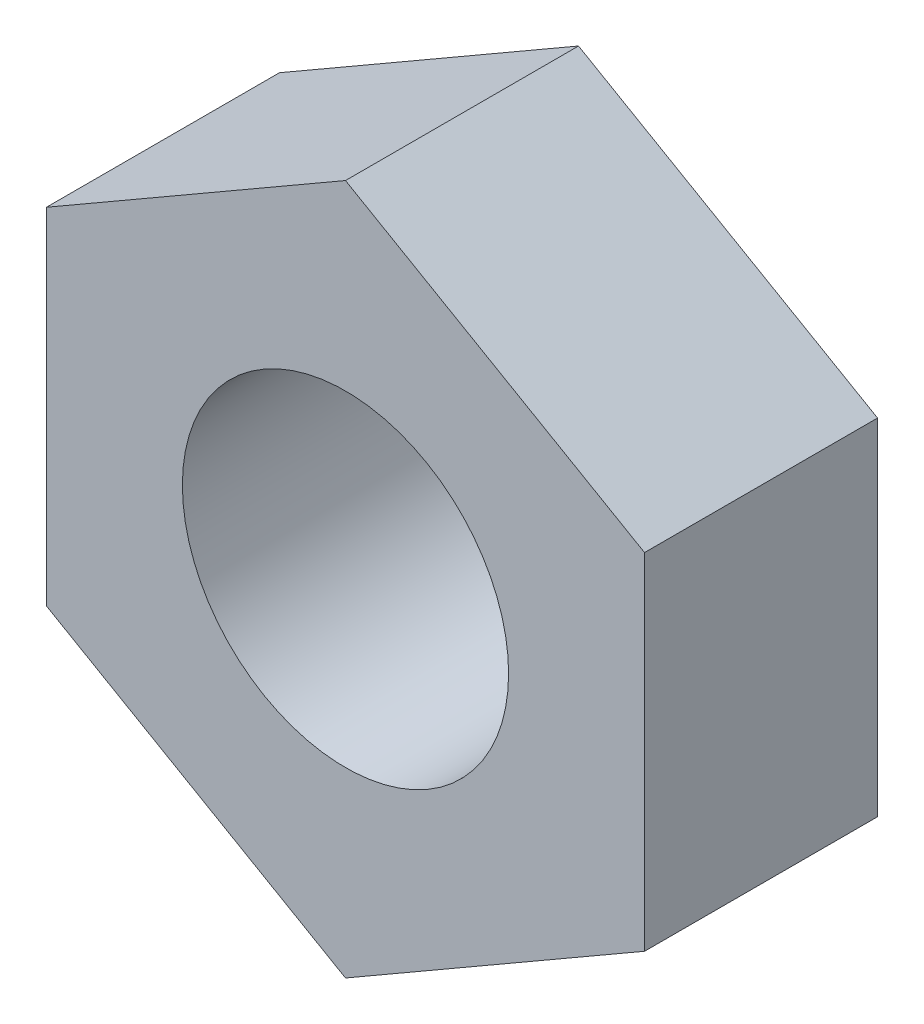
from build123d import *

# Parameters (mm, degrees)
BOSS_EXTRUDE1_DEPTH         = 3
TAP_DRILL_FOR_M5X0_8_TAP1_D = 4.2


with BuildPart() as part:
    # Sketch1 → Boss-Extrude1 (new body)
    with BuildSketch(Plane(origin=(0, 0, 0), x_dir=(0, 1, 0), z_dir=(0, 0, 1))):
        Polygon((-4.445597073, 0), (-2.222798536, -3.85), (2.222798536, -3.85), (4.445597073, 0), (2.222798536, 3.85), (-2.222798536, 3.85), align=None)
    extrude(amount=BOSS_EXTRUDE1_DEPTH)

    # Tap Drill for M5x0.8 Tap1 (through all)
    with Locations(Plane.XY.offset(3)):
        with Locations((0, 0)):
            Hole(TAP_DRILL_FOR_M5X0_8_TAP1_D / 2)


solid = part.part
